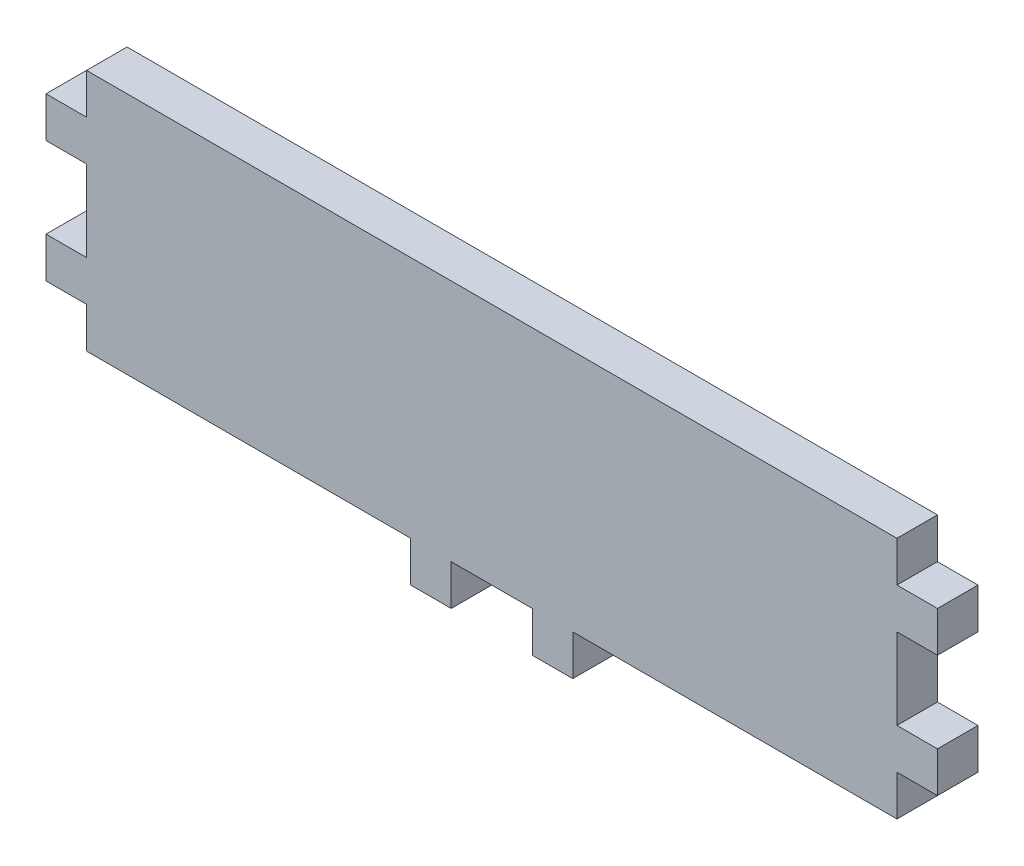
from build123d import *

# Parameters (mm, degrees)
BOSS_EXTRUDE1_DEPTH = 5


with BuildPart() as part:
    # Sketch1 → Boss-Extrude1 (new body)
    with BuildSketch(Plane.XY):
        Polygon((0, 0), (0, 5), (-40, 5), (-40, 10.000274966), (-45, 10.000274966), (-45, 15.000274966), (-40, 15.000274966), (-40, 25.000274966), (-45, 25.000274966), (-45, 30.000274966), (-40, 30.000274966), (-40, 35), (60, 35), (60, 30.000274966), (65, 30.000274966), (65, 25.000274966), (60, 25.000274966), (60, 15.000274966), (65, 15.000274966), (65, 10.000274966), (60, 10.000274966), (60, 5), (20, 5), (20, 0), (15, 0), (15, 5), (5, 5), (5, 0), align=None)
    extrude(amount=BOSS_EXTRUDE1_DEPTH)


solid = part.part
